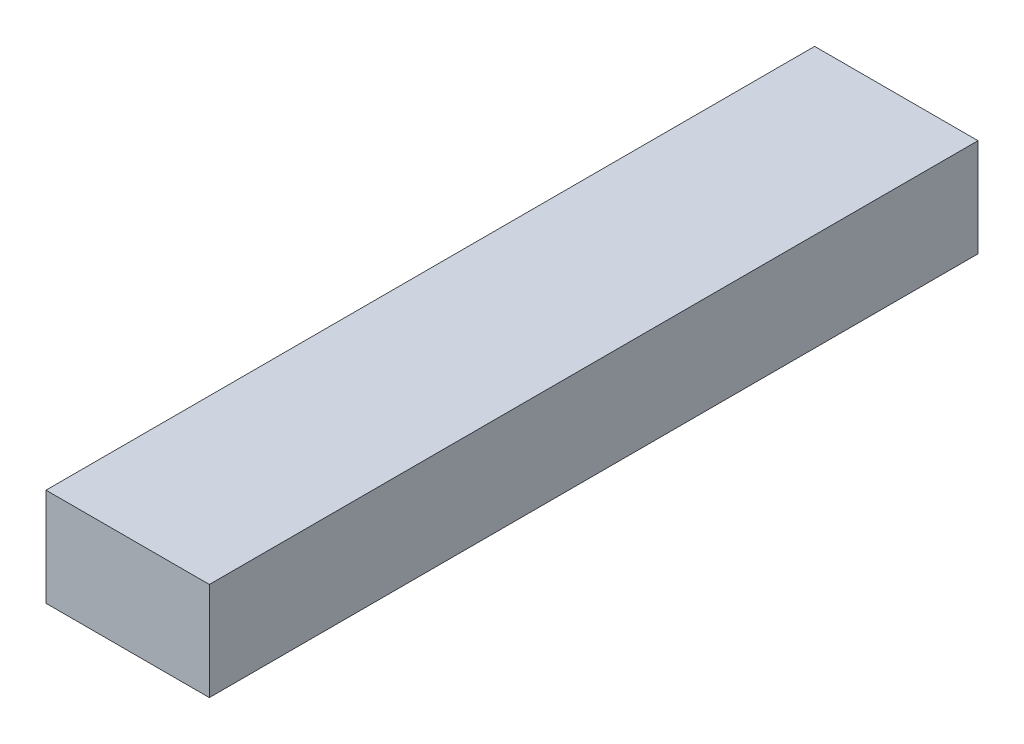
from build123d import *

# Parameters (mm, degrees)
SKETCH1_W           = 63.5
SKETCH1_H           = 38.1
BOSS_EXTRUDE1_DEPTH = 298.8


with BuildPart() as part:
    # Sketch1 → Boss-Extrude1 (new body)
    with BuildSketch(Plane.XY):
        with Locations((31.75, 19.05)):
            Rectangle(SKETCH1_W, SKETCH1_H)
    extrude(amount=-BOSS_EXTRUDE1_DEPTH)


solid = part.part
